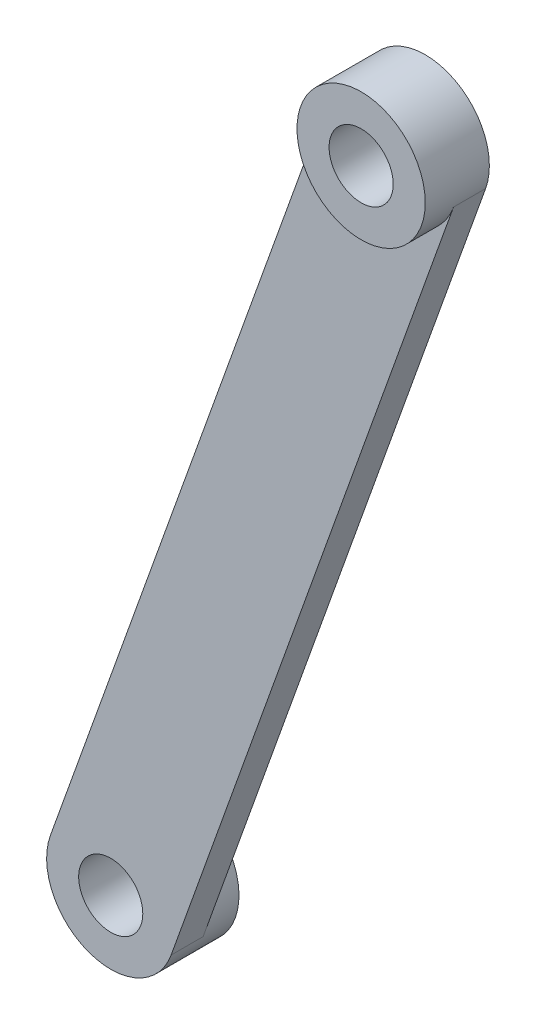
from build123d import *

# Parameters (mm, degrees)
BOSS_EXTRUDE1_START = -1.5875
SKETCH1_R           = 1.5875
BOSS_EXTRUDE1_DEPTH = 1.5875
BOSS_EXTRUDE2_START = 1.5875
SKETCH3_R           = 3.175
SKETCH3_R_2         = 1.5875
BOSS_EXTRUDE2_DEPTH = 1.5875
SKETCH4_R           = 3.175
SKETCH4_R_2         = 1.5875
BOSS_EXTRUDE3_DEPTH = 1.5875


with BuildPart() as part:
    # Sketch1 → Boss-Extrude1 (new body)
    with BuildSketch(Plane.XY.offset(BOSS_EXTRUDE1_START)):
        with BuildLine():
            Line((-40.989250829, -6.729951179), (-27.002785927, 32.342146276))
            ThreePointArc((-27.002785927, 32.342146276), (-22.943486276, 34.261348284), (-21.024284268, 30.202048634))
            Line((-21.024284268, 30.202048634), (-35.010749171, -8.870048821))
            ThreePointArc((-35.010749171, -8.870048821), (-39.070048821, -10.789250829), (-40.989250829, -6.729951179))
        make_face()
        with Locations((-24.013535097, 31.272097455)):
            Circle(SKETCH1_R, mode=Mode.SUBTRACT)
        with Locations((-38, -7.8)):
            Circle(SKETCH1_R, mode=Mode.SUBTRACT)
    extrude(amount=-BOSS_EXTRUDE1_DEPTH)

    # Sketch3 → Boss-Extrude2 (add)
    with BuildSketch(Plane.XY.offset(-1.5875).offset(BOSS_EXTRUDE2_START)):
        with Locations((-24.013535097, 31.272097455)):
            Circle(SKETCH3_R)
        with Locations((-24.013535097, 31.272097455)):
            Circle(SKETCH3_R_2, mode=Mode.SUBTRACT)
    extrude(amount=-BOSS_EXTRUDE2_DEPTH)

    # Sketch4 → Boss-Extrude3 (add)
    with BuildSketch(Plane(origin=(0, 0, -3.175), x_dir=(-1, 0, 0), z_dir=(0, 0, -1))):
        with Locations(Location((38, -7.8, 0), (0, 0, 199.69561783))):
            Circle(SKETCH4_R)
        with Locations(Location((38, -7.8, 0), (0, 0, 180))):
            Circle(SKETCH4_R_2, mode=Mode.SUBTRACT)
    extrude(amount=BOSS_EXTRUDE3_DEPTH)


solid = part.part
